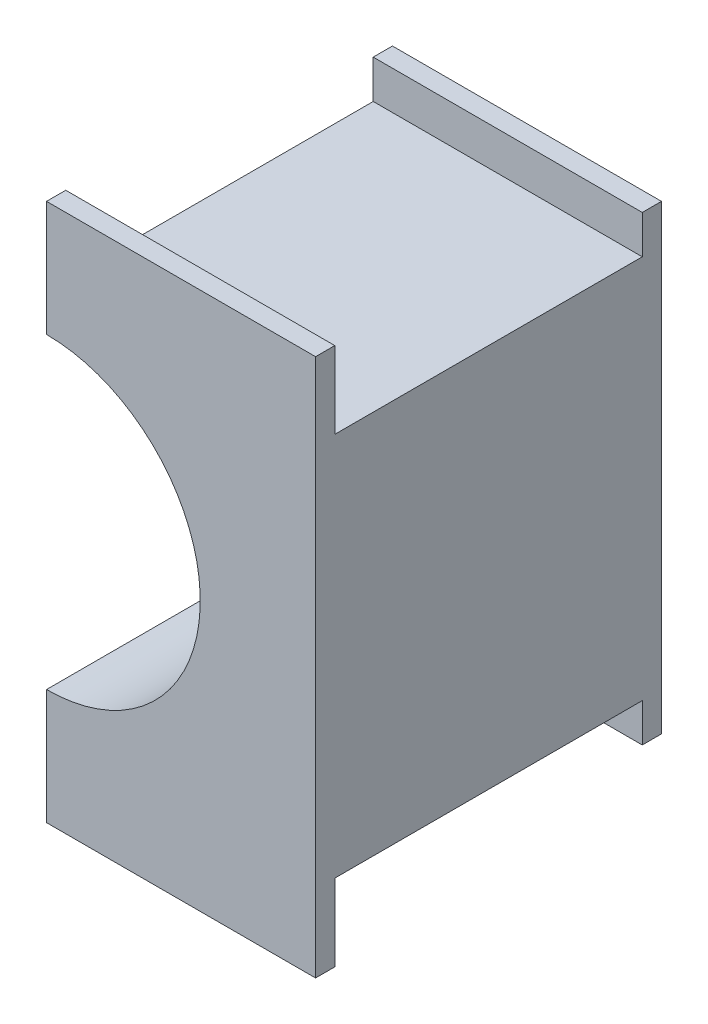
from build123d import *

# Parameters (mm, degrees)
BOSS_EXTRU_1_DEPTH      = 4.5
ESQUISSE2_W             = 4
ESQUISSE2_H             = 0.5
ENL_V_MAT_EXTRU_2_DEPTH = 7.68954408


with BuildPart() as part:
    # Esquisse1 → Boss.-Extru.1 (new body)
    with BuildSketch(Plane.XY):
        with BuildLine():
            Line((1, 3.5), (-2.5, 3.5))
            Line((-2.5, 3.5), (-2.5, 2))
            ThreePointArc((-2.5, 2), (-0.5, 0), (-2.5, -2))
            Line((-2.5, -2), (-2.5, -3.5))
            Line((-2.5, -3.5), (1, -3.5))
            Line((1, -3.5), (1, 3.5))
        make_face()
    extrude(amount=BOSS_EXTRU_1_DEPTH)

    # Esquisse2 → Enlèv. mat.-Extru.2 (cut, through all)
    with BuildSketch(Plane.ZY.offset(2.5)):
        Polygon((4.25, 3.5), (0, 3.5), (0, 3), (0.25, 3), (4.25, 3), align=None)
        with Locations((2.25, 2.75)):
            Rectangle(ESQUISSE2_W, ESQUISSE2_H)
        with Locations((2.25, -2.75)):
            Rectangle(ESQUISSE2_W, ESQUISSE2_H)
        Polygon((4.25, -3), (0.25, -3), (0, -3), (0, -3.5), (4.25, -3.5), align=None)
    extrude(amount=-ENL_V_MAT_EXTRU_2_DEPTH, mode=Mode.SUBTRACT)


solid = part.part
